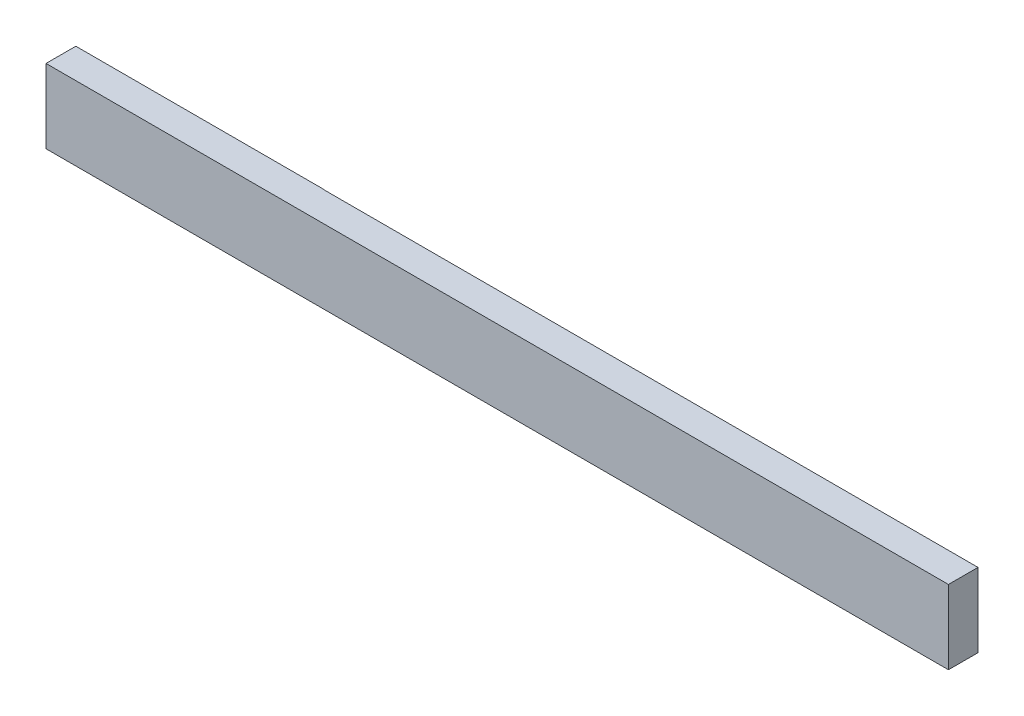
from build123d import *

# Parameters (mm, degrees)
SKETCH1_W           = 47
SKETCH1_H           = 22
BOSS_EXTRUDE1_DEPTH = 10
SKETCH2_W           = 4.035688101
SKETCH2_H           = 10
BOSS_EXTRUDE2_DEPTH = 75.1
SKETCH5_W           = 120.095594562
SKETCH5_H           = 66.646456322
CUT_EXTRUDE1_DEPTH  = 18


with BuildPart() as part:
    # Sketch1 → Boss-Extrude1 (new body)
    with BuildSketch(Plane(origin=(0, 0, 0), x_dir=(1, 0, 0), z_dir=(0, 1, 0))):
        with Locations((23.5, 11)):
            Rectangle(SKETCH1_W, SKETCH1_H)
    extrude(amount=BOSS_EXTRUDE1_DEPTH)

    # Sketch2 → Boss-Extrude2 (add)
    with BuildSketch(Plane.ZY):
        with Locations((-2.01784405, 5)):
            Rectangle(SKETCH2_W, SKETCH2_H)
    extrude(amount=BOSS_EXTRUDE2_DEPTH)

    # Sketch5 → Cut-Extrude1 (cut)
    with BuildSketch(Plane(origin=(0, 0, -22), x_dir=(-1, 0, 0), z_dir=(0, 0, -1))):
        with Locations((-18.547375667, 4.208160915)):
            Rectangle(SKETCH5_W, SKETCH5_H)
    extrude(amount=-CUT_EXTRUDE1_DEPTH, mode=Mode.SUBTRACT)


solid = part.part
